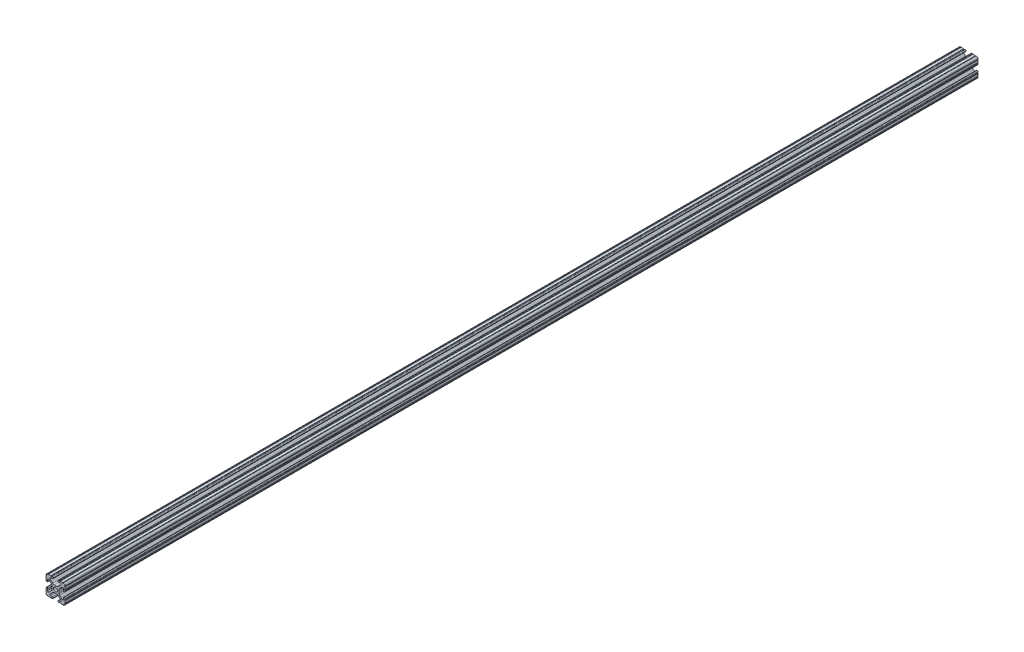
from build123d import *

# Parameters (mm, degrees)
SKETCH1_R      = 2.6035
EXTRUDE1_DEPTH = 1219.2


with BuildPart() as part:
    # Sketch1 → Extrude1 (new body)
    with BuildSketch(Plane.XY):
        with BuildLine():
            Line((-7.207036008, 8.724370562), (-3.898272566, 5.423169045))
            ThreePointArc((-3.898272566, 5.423169045), (-2.869120213, 4.736787962), (-1.655778399, 4.4958))
            Line((-1.655778399, 4.4958), (1.655778399, 4.4958))
            ThreePointArc((1.655778399, 4.4958), (2.869120213, 4.736787962), (3.898272566, 5.423169045))
            Line((3.898272566, 5.423169045), (7.207036008, 8.724370562))
            ThreePointArc((7.207036008, 8.724370562), (7.432222385, 9.85140422), (6.476788598, 10.4902))
            Line((6.476788598, 10.4902), (4.287512407, 10.4902))
            ThreePointArc((4.287512407, 10.4902), (3.54574862, 10.79744862), (3.2385, 11.539212407))
            Line((3.2385, 11.539212407), (3.2385, 11.650987593))
            ThreePointArc((3.2385, 11.650987593), (3.54574862, 12.39275138), (4.287512407, 12.7))
            Line((4.287512407, 12.7), (5.317126718, 12.7))
            ThreePointArc((5.317126718, 12.7), (5.825126718, 12.192), (6.333126718, 12.7))
            Line((6.333126718, 12.7), (9.550443118, 12.7))
            ThreePointArc((9.550443118, 12.7), (10.058366869, 12.192000006), (10.566443095, 12.699847501))
            ThreePointArc((10.566443095, 12.699847501), (12.082537762, 12.08250727), (12.699846982, 10.566399977))
            ThreePointArc((12.699846982, 10.566399977), (12.192000006, 10.058323491), (12.7, 9.5504))
            Line((12.7, 9.5504), (12.7, 6.3330836))
            ThreePointArc((12.7, 6.3330836), (12.192, 5.8250836), (12.7, 5.3170836))
            Line((12.7, 5.3170836), (12.7, 4.287469289))
            ThreePointArc((12.7, 4.287469289), (12.39275138, 3.545705502), (11.650987593, 3.238456882))
            Line((11.650987593, 3.238456882), (11.539212407, 3.238456882))
            ThreePointArc((11.539212407, 3.238456882), (10.79744862, 3.545705502), (10.4902, 4.287469289))
            Line((10.4902, 4.287469289), (10.4902, 6.402089023))
            ThreePointArc((10.4902, 6.402089023), (9.856505071, 7.351067942), (8.737131347, 7.129408934))
            Line((8.737131347, 7.129408934), (5.441005833, 3.840816462))
            ThreePointArc((5.441005833, 3.840816462), (4.750877967, 2.809883091), (4.5085, 1.593185507))
            Line((4.5085, 1.593185507), (4.5085, -1.593185507))
            ThreePointArc((4.5085, -1.593185507), (4.750877967, -2.809883091), (5.441005833, -3.840816462))
            Line((5.441005833, -3.840816462), (8.737131347, -7.129408934))
            ThreePointArc((8.737131347, -7.129408934), (9.856505071, -7.351067942), (10.4902, -6.402089023))
            Line((10.4902, -6.402089023), (10.4902, -4.287469289))
            ThreePointArc((10.4902, -4.287469289), (10.79744862, -3.545705502), (11.539212407, -3.238456882))
            Line((11.539212407, -3.238456882), (11.650987593, -3.238456882))
            ThreePointArc((11.650987593, -3.238456882), (12.39275138, -3.545705502), (12.7, -4.287469289))
            Line((12.7, -4.287469289), (12.7, -5.3170836))
            ThreePointArc((12.7, -5.3170836), (12.192, -5.8250836), (12.7, -6.3330836))
            Line((12.7, -6.3330836), (12.7, -9.5504))
            ThreePointArc((12.7, -9.5504), (12.192000006, -10.058323491), (12.699846982, -10.566399977))
            ThreePointArc((12.699846982, -10.566399977), (12.082537762, -12.08250727), (10.566443095, -12.699847501))
            ThreePointArc((10.566443095, -12.699847501), (10.058366869, -12.192000006), (9.550443118, -12.7))
            Line((9.550443118, -12.7), (6.333126718, -12.7))
            ThreePointArc((6.333126718, -12.7), (5.825126718, -12.192), (5.317126718, -12.7))
            Line((5.317126718, -12.7), (4.287512407, -12.7))
            ThreePointArc((4.287512407, -12.7), (3.54574862, -12.39275138), (3.2385, -11.650987593))
            Line((3.2385, -11.650987593), (3.2385, -11.539212407))
            ThreePointArc((3.2385, -11.539212407), (3.54574862, -10.79744862), (4.287512407, -10.4902))
            Line((4.287512407, -10.4902), (6.416408329, -10.4902))
            ThreePointArc((6.416408329, -10.4902), (7.41473083, -9.822813117), (7.179650497, -8.645192506))
            Line((7.179650497, -8.645192506), (3.952270251, -5.423690499))
            ThreePointArc((3.952270251, -5.423690499), (2.922936451, -4.736929036), (1.709253557, -4.4958))
            Line((1.709253557, -4.4958), (-1.709253557, -4.4958))
            ThreePointArc((-1.709253557, -4.4958), (-2.922936451, -4.736929036), (-3.952270251, -5.423690499))
            Line((-3.952270251, -5.423690499), (-7.179650497, -8.645192506))
            ThreePointArc((-7.179650497, -8.645192506), (-7.41473083, -9.822813117), (-6.416408329, -10.4902))
            Line((-6.416408329, -10.4902), (-4.287512407, -10.4902))
            ThreePointArc((-4.287512407, -10.4902), (-3.54574862, -10.79744862), (-3.2385, -11.539212407))
            Line((-3.2385, -11.539212407), (-3.2385, -11.650987593))
            ThreePointArc((-3.2385, -11.650987593), (-3.54574862, -12.39275138), (-4.287512407, -12.7))
            Line((-4.287512407, -12.7), (-5.317126718, -12.7))
            ThreePointArc((-5.317126718, -12.7), (-5.825126718, -12.192), (-6.333126718, -12.7))
            Line((-6.333126718, -12.7), (-9.550443118, -12.7))
            ThreePointArc((-9.550443118, -12.7), (-10.058366869, -12.192000006), (-10.566443095, -12.699847501))
            ThreePointArc((-10.566443095, -12.699847501), (-12.082537762, -12.08250727), (-12.699846982, -10.566399977))
            ThreePointArc((-12.699846982, -10.566399977), (-12.192000006, -10.058323491), (-12.7, -9.5504))
            Line((-12.7, -9.5504), (-12.7, -6.3330836))
            ThreePointArc((-12.7, -6.3330836), (-12.192, -5.8250836), (-12.7, -5.3170836))
            Line((-12.7, -5.3170836), (-12.7, -4.287469289))
            ThreePointArc((-12.7, -4.287469289), (-12.39275138, -3.545705502), (-11.650987593, -3.238456882))
            Line((-11.650987593, -3.238456882), (-11.539212407, -3.238456882))
            ThreePointArc((-11.539212407, -3.238456882), (-10.79744862, -3.545705502), (-10.4902, -4.287469289))
            Line((-10.4902, -4.287469289), (-10.4902, -6.402089023))
            ThreePointArc((-10.4902, -6.402089023), (-9.856505071, -7.351067942), (-8.737131347, -7.129408934))
            Line((-8.737131347, -7.129408934), (-5.441005833, -3.840816462))
            ThreePointArc((-5.441005833, -3.840816462), (-4.750877967, -2.809883091), (-4.5085, -1.593185507))
            Line((-4.5085, -1.593185507), (-4.5085, 1.593185507))
            ThreePointArc((-4.5085, 1.593185507), (-4.750877967, 2.809883091), (-5.441005833, 3.840816462))
            Line((-5.441005833, 3.840816462), (-8.737131347, 7.129408934))
            ThreePointArc((-8.737131347, 7.129408934), (-9.856505071, 7.351067942), (-10.4902, 6.402089023))
            Line((-10.4902, 6.402089023), (-10.4902, 4.287469289))
            ThreePointArc((-10.4902, 4.287469289), (-10.79744862, 3.545705502), (-11.539212407, 3.238456882))
            Line((-11.539212407, 3.238456882), (-11.650987593, 3.238456882))
            ThreePointArc((-11.650987593, 3.238456882), (-12.39275138, 3.545705502), (-12.7, 4.287469289))
            Line((-12.7, 4.287469289), (-12.7, 5.3170836))
            ThreePointArc((-12.7, 5.3170836), (-12.192, 5.8250836), (-12.7, 6.3330836))
            Line((-12.7, 6.3330836), (-12.7, 9.5504))
            ThreePointArc((-12.7, 9.5504), (-12.192000006, 10.058323491), (-12.699846982, 10.566399977))
            ThreePointArc((-12.699846982, 10.566399977), (-12.082537762, 12.08250727), (-10.566443095, 12.699847501))
            ThreePointArc((-10.566443095, 12.699847501), (-10.058366869, 12.192000006), (-9.550443118, 12.7))
            Line((-9.550443118, 12.7), (-6.333126718, 12.7))
            ThreePointArc((-6.333126718, 12.7), (-5.825126718, 12.192), (-5.317126718, 12.7))
            Line((-5.317126718, 12.7), (-4.287512407, 12.7))
            ThreePointArc((-4.287512407, 12.7), (-3.54574862, 12.39275138), (-3.2385, 11.650987593))
            Line((-3.2385, 11.650987593), (-3.2385, 11.539212407))
            ThreePointArc((-3.2385, 11.539212407), (-3.54574862, 10.79744862), (-4.287512407, 10.4902))
            Line((-4.287512407, 10.4902), (-6.476788598, 10.4902))
            ThreePointArc((-6.476788598, 10.4902), (-7.432222385, 9.85140422), (-7.207036008, 8.724370562))
        make_face()
        Circle(SKETCH1_R, mode=Mode.SUBTRACT)
    extrude(amount=-EXTRUDE1_DEPTH)


solid = part.part
